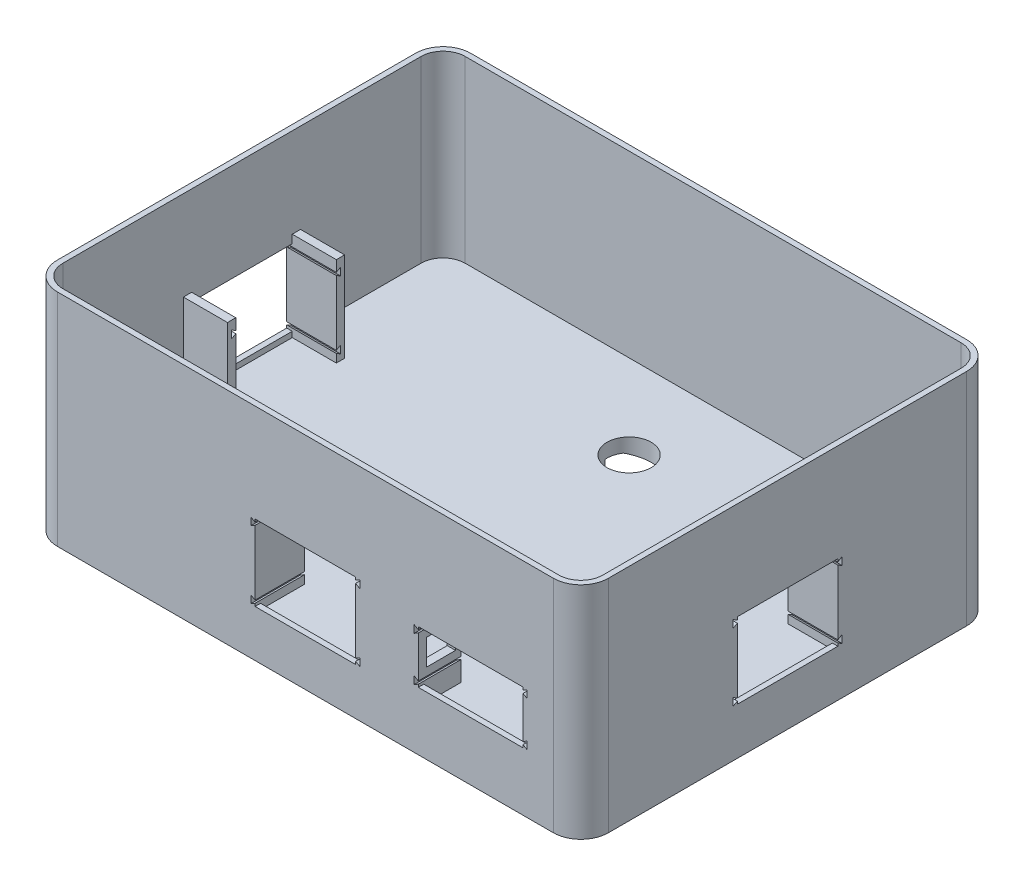
from build123d import *

# Parameters (mm, degrees)
SKETCH2_W                = 200
SKETCH2_H                = 150
BOSS_EXTRUDE1_DEPTH      = 80
FILLET1_R                = 10
SHELL1_T                 = -2
SHELL1_THICKNESS_2_DEPTH = 13
SKETCH5_W                = 36.5
SKETCH5_H                = 27.5
CUT_EXTRUDE1_DEPTH       = 2
BOSS_EXTRUDE2_DEPTH      = 16
SKETCH7_W                = 36.5
SKETCH7_H                = 27.5
CUT_EXTRUDE2_DEPTH       = 2
BOSS_EXTRUDE3_DEPTH      = 16
SKETCH10_W               = 36.5
SKETCH10_H               = 27.5
CUT_EXTRUDE4_DEPTH       = 2
BOSS_EXTRUDE4_DEPTH      = 16
SKETCH13_W               = 38
SKETCH13_H               = 19.1
CUT_EXTRUDE5_DEPTH       = 2
BOSS_EXTRUDE5_DEPTH      = 13.5
SKETCH15_W               = 10.5
SKETCH15_H               = 9.367949192
CUT_EXTRUDE6_DEPTH       = 3
CUT_EXTRUDE8_REACH       = 150.408
SKETCH20_R               = 8


with BuildPart() as part:
    # Sketch2 → Boss-Extrude1 (new body)
    with BuildSketch(Plane(origin=(0, 0, 0), x_dir=(1, 0, 0), z_dir=(0, 1, 0))):
        Rectangle(SKETCH2_W, SKETCH2_H)
    extrude(amount=BOSS_EXTRUDE1_DEPTH)

    # Fillet1
    fillet1_edges = [part.edges().sort_by_distance(p)[0] for p in [
        (100, 40, 75),
        (-100, 40, 75),
        (-100, 40, -75),
        (100, 40, -75),
    ]]
    fillet(fillet1_edges, radius=FILLET1_R)

    # Shell1
    shell1_openings = [part.faces().sort_by_distance(p)[0] for p in [
        (0, 80, 0),
    ]]
    offset(amount=SHELL1_T, openings=shell1_openings, kind=Kind.INTERSECTION)

    # Shell1 thickness 2 face (on inner face of the shell) → Shell1 thickness 2 (add)
    with BuildSketch(Plane(origin=(0, 2, 0), x_dir=(0, 0, -1), z_dir=(0, -1, 0))):
        with BuildLine():
            ThreePointArc((73, -90), (70.656854249, -95.656854249), (65, -98))
            Line((65, -98), (-65, -98))
            ThreePointArc((-65, -98), (-70.656854249, -95.656854249), (-73, -90))
            Line((-73, -90), (-73, 90))
            ThreePointArc((-73, 90), (-70.656854249, 95.656854249), (-65, 98))
            Line((-65, 98), (65, 98))
            ThreePointArc((65, 98), (70.656854249, 95.656854249), (73, 90))
            Line((73, 90), (73, -90))
        make_face()
    extrude(amount=-SHELL1_THICKNESS_2_DEPTH)

    # Sketch5 → Cut-Extrude1 (cut)
    with BuildSketch(Plane.XY.offset(75)):
        with Locations((0, 30.75)):
            Rectangle(SKETCH5_W, SKETCH5_H)
        Polygon((-18.25, 43.5), (-19.75, 44.366025404), (-19.75, 41.633974596), (-18.25, 42.5), align=None)
        Polygon((-19.75, 19.866025404), (-18.25, 19), (-18.25, 18), (-19.75, 17.133974596), align=None)
        Polygon((19.75, 17.133974596), (19.75, 19.866025404), (18.25, 19), (18.25, 18), align=None)
        Polygon((19.75, 41.633974596), (18.25, 42.5), (18.25, 43.5), (19.75, 44.366025404), align=None)
    extrude(amount=-CUT_EXTRUDE1_DEPTH, mode=Mode.SUBTRACT)

    # Sketch6 → Boss-Extrude2 (add)
    with BuildSketch(Plane(origin=(0, 0, 73), x_dir=(-1, 0, 0), z_dir=(0, 0, -1))):
        Polygon((18.25, 15), (21.25, 15), (21.25, 47.5), (18.25, 47.5), (18.25, 43.5), (19.75, 44.366025404), (19.75, 41.633974596), (18.25, 42.5), (18.25, 19), (19.75, 19.866025404), (19.75, 17.133974596), (18.25, 18), align=None)
        Polygon((-21.25, 47.5), (-21.25, 15), (-18.25, 15), (-18.25, 18), (-19.75, 17.133974596), (-19.75, 19.866025404), (-18.25, 19), (-18.25, 42.5), (-19.75, 41.633974596), (-19.75, 44.366025404), (-18.25, 43.5), (-18.25, 47.5), align=None)
    extrude(amount=BOSS_EXTRUDE2_DEPTH)

    # Sketch7 → Cut-Extrude2 (cut)
    with BuildSketch(Plane(origin=(100, 0, 0), x_dir=(0, 0, -1), z_dir=(1, 0, 0))):
        with Locations((0, 30.75)):
            Rectangle(SKETCH7_W, SKETCH7_H)
        Polygon((-18.25, 43.5), (-19.75, 44.366025404), (-19.75, 41.633974596), (-18.25, 42.5), align=None)
        Polygon((-19.75, 19.866025404), (-18.25, 19), (-18.25, 18), (-19.75, 17.133974596), align=None)
        Polygon((19.75, 17.133974596), (19.75, 19.866025404), (18.25, 19), (18.25, 18), align=None)
        Polygon((19.75, 41.633974596), (18.25, 42.5), (18.25, 43.5), (19.75, 44.366025404), align=None)
    extrude(amount=-CUT_EXTRUDE2_DEPTH, mode=Mode.SUBTRACT)

    # Sketch8 → Boss-Extrude3 (add)
    with BuildSketch(Plane.ZY.offset(-98)):
        Polygon((-21.25, 47.5), (-18.25, 47.5), (-18.25, 43.5), (-19.75, 44.366025404), (-19.75, 41.633974596), (-18.25, 42.5), (-18.25, 19), (-19.75, 19.866025404), (-19.75, 17.133974596), (-18.25, 18), (-18.25, 15), (-21.25, 15), align=None)
        Polygon((19.75, 44.366025404), (18.25, 43.5), (18.25, 47.5), (21.25, 47.5), (21.25, 15), (18.25, 15), (18.25, 18), (19.75, 17.133974596), (19.75, 19.866025404), (18.25, 19), (18.25, 42.5), (19.75, 41.633974596), align=None)
    extrude(amount=BOSS_EXTRUDE3_DEPTH)

    # Sketch10 → Cut-Extrude4 (cut)
    with BuildSketch(Plane.ZY.offset(100)):
        with Locations((0, 30.75)):
            Rectangle(SKETCH10_W, SKETCH10_H)
        Polygon((-18.25, 43.5), (-19.75, 44.366025404), (-19.75, 41.633974596), (-18.25, 42.5), align=None)
        Polygon((-19.75, 19.866025404), (-18.25, 19), (-18.25, 18), (-19.75, 17.133974596), align=None)
        Polygon((19.75, 17.133974596), (19.75, 19.866025404), (18.25, 19), (18.25, 18), align=None)
        Polygon((19.75, 41.633974596), (18.25, 42.5), (18.25, 43.5), (19.75, 44.366025404), align=None)
    extrude(amount=-CUT_EXTRUDE4_DEPTH, mode=Mode.SUBTRACT)

    # Sketch11 → Boss-Extrude4 (add)
    with BuildSketch(Plane(origin=(-98, 0, 0), x_dir=(0, 0, -1), z_dir=(1, 0, 0))):
        Polygon((-18.25, 47.5), (-21.25, 47.5), (-21.25, 15), (-18.25, 15), (-18.25, 18), (-19.75, 17.133974596), (-19.75, 19.866025404), (-18.25, 19), (-18.25, 42.5), (-19.75, 41.633974596), (-19.75, 44.366025404), (-18.25, 43.5), align=None)
        Polygon((19.75, 44.366025404), (18.25, 43.5), (18.25, 47.5), (21.25, 47.5), (21.25, 15), (18.25, 15), (18.25, 18), (19.75, 17.133974596), (19.75, 19.866025404), (18.25, 19), (18.25, 42.5), (19.75, 41.633974596), align=None)
    extrude(amount=BOSS_EXTRUDE4_DEPTH)

    # Sketch13 → Cut-Extrude5 (cut)
    with BuildSketch(Plane.XY.offset(75)):
        Polygon((41, 39.3), (39.5, 40.166025404), (39.5, 37.433974596), (41, 38.3), align=None)
        with Locations((60, 30.75)):
            Rectangle(SKETCH13_W, SKETCH13_H)
        Polygon((41, 22.2), (39.5, 21.333974596), (39.5, 24.066025404), (41, 23.2), align=None)
        Polygon((79, 22.2), (79, 23.2), (80.5, 24.066025404), (80.5, 21.333974596), align=None)
        Polygon((79, 39.3), (80.5, 40.166025404), (80.5, 37.433974596), (79, 38.3), align=None)
    extrude(amount=-CUT_EXTRUDE5_DEPTH, mode=Mode.SUBTRACT)

    # Sketch14 → Boss-Extrude5 (add)
    with BuildSketch(Plane(origin=(0, 0, 73), x_dir=(-1, 0, 0), z_dir=(0, 0, -1))):
        Polygon((-79, 43.3), (-82, 43.3), (-82, 15), (-79, 15), (-79, 22.2), (-80.5, 21.333974596), (-80.5, 24.066025404), (-79, 23.2), (-79, 38.3), (-80.5, 37.433974596), (-80.5, 40.166025404), (-79, 39.3), align=None)
        Polygon((-39.5, 40.166025404), (-41, 39.3), (-41, 43.3), (-38, 43.3), (-38, 15), (-41, 15), (-41, 22.2), (-39.5, 21.333974596), (-39.5, 24.066025404), (-41, 23.2), (-41, 38.3), (-39.5, 37.433974596), align=None)
    extrude(amount=BOSS_EXTRUDE5_DEPTH)

    # Sketch15 → Cut-Extrude6 (cut)
    with BuildSketch(Plane.ZY.offset(-38)):
        with Locations((66.75, 30.75)):
            Rectangle(SKETCH15_W, SKETCH15_H)
    extrude(amount=-CUT_EXTRUDE6_DEPTH, mode=Mode.SUBTRACT)

    # Sketch18 → Cut-Revolve1 (revolve, cut)
    with BuildSketch(Plane(origin=(0, 0, 0), x_dir=(0, 0, -1), z_dir=(1, 0, 0)), mode=Mode.PRIVATE) as cut_revolve1_sk:
        Polygon((-42.5, 0), (-70, 0), (-47.5, 10), (-42.5, 10), align=None)
    revolve(cut_revolve1_sk.sketch.rotate(Axis((0, 0, 0), (0, 1, 0)), 180), axis=Axis((0, 0, 0), (0, 1, 0)), mode=Mode.SUBTRACT)

    # Cut-Extrude8: up to this face of the body (flat: up to its plane)
    cut_extrude8_end = Plane(part.part.faces().sort_by_distance((-0.172388952, 15, -0.411685035))[0])
    # Sketch20 → Cut-Extrude8 (cut, up to the picked face)
    with BuildSketch(Plane.XZ, mode=Mode.PRIVATE) as cut_extrude8_sk1:
        with Locations(Location((0, -42.5, 0), (0, 0, 270))):
            Circle(SKETCH20_R)
    cut_extrude8_tool1 = split(extrude(cut_extrude8_sk1.sketch, amount=-CUT_EXTRUDE8_REACH, mode=Mode.PRIVATE), bisect_by=cut_extrude8_end, keep=Keep.BOTH, mode=Mode.PRIVATE)
    add(cut_extrude8_tool1.solids().sort_by(Axis((0, 0, -42.5), (0, 1, 0)))[0], mode=Mode.SUBTRACT)


solid = part.part
